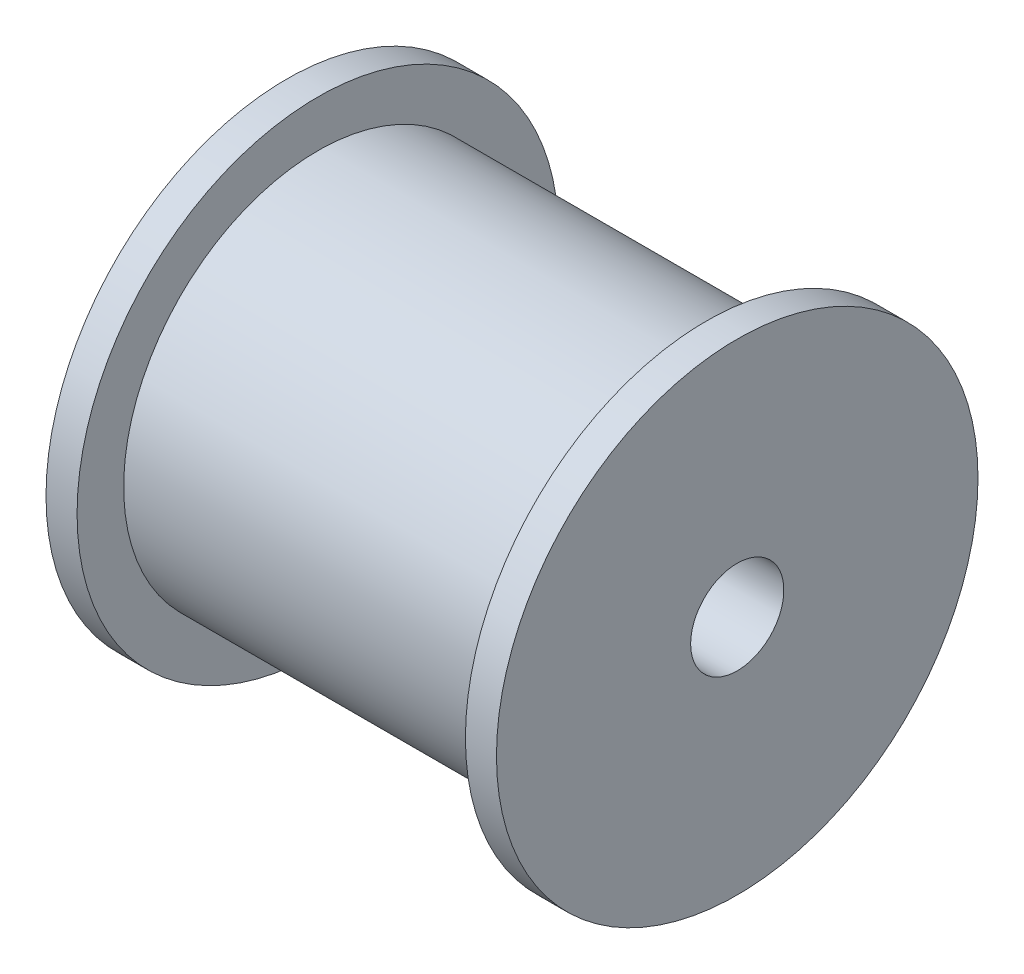
from build123d import *

# Parameters (mm, degrees)
SKETCH1_R           = 125
BOSS_EXTRUDE1_DEPTH = 250
SKETCH2_R           = 155
BOSS_EXTRUDE2_DEPTH = 20
SKETCH3_R           = 30
CUT_EXTRUDE1_DEPTH  = 364.524414586


with BuildPart() as part:
    # Sketch1 → Boss-Extrude1 (new body)
    with BuildSketch(Plane(origin=(0, 0, 0), x_dir=(0, 0, -1), z_dir=(1, 0, 0))):
        Circle(SKETCH1_R)
    extrude(amount=BOSS_EXTRUDE1_DEPTH)

    # Sketch2 → Boss-Extrude2 (add)
    with BuildSketch(Plane(origin=(0, 0, 0), x_dir=(0, 0, -1), z_dir=(1, 0, 0))):
        Circle(SKETCH2_R)
    boss_extrude2 = extrude(amount=-BOSS_EXTRUDE2_DEPTH)

    # Mirror1: Boss-Extrude2 across plane
    add(boss_extrude2.mirror(Plane(origin=(125, 0, 0), x_dir=(0, 0, 1), z_dir=(1, 0, 0))))

    # Sketch3 → Cut-Extrude1 (cut, through all)
    with BuildSketch(Plane.ZY.offset(20)):
        Circle(SKETCH3_R)
    extrude(amount=-CUT_EXTRUDE1_DEPTH, mode=Mode.SUBTRACT)


solid = part.part
